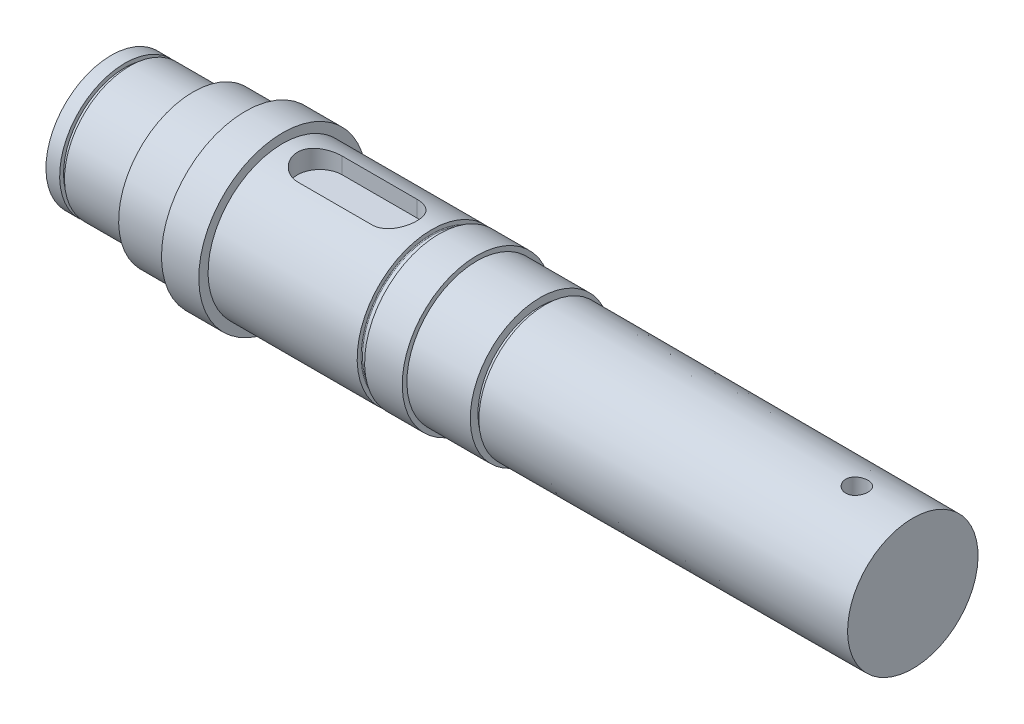
from build123d import *

# Parameters (mm, degrees)
CUT_EXTRUDE1_START = 15
CUT_EXTRUDE1_DEPTH = 6.2
SKETCH3_R          = 3
CUT_EXTRUDE2_DEPTH = 25


with BuildPart() as part:
    # Sketch1 → Revolve1 (revolve)
    with BuildSketch(Plane.XY):
        with BuildLine():
            Line((5.814948309, -5.914886223), (5.814948309, 11.585113777))
            Line((5.814948309, 11.585113777), (9.483069109, 11.585113777))
            Line((9.483069109, 11.585113777), (9.483069109, 10.535113777))
            Line((9.483069109, 10.535113777), (10.783069109, 10.535113777))
            Line((10.783069109, 10.535113777), (10.783069109, 11.585113777))
            Line((10.783069109, 11.585113777), (27.814948309, 11.585113777))
            Line((27.814948309, 11.585113777), (27.814948309, 14.085113777))
            Line((27.814948309, 14.085113777), (41.814948309, 14.085113777))
            Line((41.814948309, 14.085113777), (41.814948309, 16.585113777))
            Line((41.814948309, 16.585113777), (51.814948309, 16.585113777))
            Line((51.814948309, 16.585113777), (51.814948309, 14.085113777))
            Line((51.814948309, 14.085113777), (91.814948309, 14.085113777))
            Line((91.814948309, 14.085113777), (91.814948309, 13.045113777))
            ThreePointArc((91.814948309, 13.045113777), (91.873526953, 12.90369242), (92.014948309, 12.845113777))
            Line((92.014948309, 12.845113777), (93.614948309, 12.845113777))
            ThreePointArc((93.614948309, 12.845113777), (93.756369665, 12.90369242), (93.814948309, 13.045113777))
            Line((93.814948309, 13.045113777), (93.814948309, 14.085113777))
            Line((93.814948309, 14.085113777), (103.914948309, 14.085113777))
            Line((103.914948309, 14.085113777), (103.914948309, 12.835113777))
            Line((103.914948309, 12.835113777), (120.914948309, 12.835113777))
            Line((120.914948309, 12.835113777), (120.914948309, 10.767496152))
            Line((120.914948309, 10.767496152), (122.214948309, 10.767496152))
            Line((122.214948309, 10.767496152), (122.214948309, 11.817496152))
            Line((122.214948309, 11.817496152), (220.914948309, 11.58768633))
            Line((220.914948309, 11.58768633), (220.914948309, -5.914886223))
            Line((220.914948309, -5.914886223), (5.814948309, -5.914886223))
        make_face()
    revolve(axis=Axis((221.999449802, -5.914886223, 0), (-1, 0, 0)))

    # Sketch2 → Cut-Extrude1 (cut)
    with BuildSketch(Plane(origin=(0, 0, 0), x_dir=(1, 0, 0), z_dir=(0, 1, 0)).offset(CUT_EXTRUDE1_START)):
        with BuildLine():
            Line((61.814948309, 6), (81.814948309, 6))
            ThreePointArc((81.814948309, 6), (87.814948309, 0), (81.814948309, -6))
            Line((81.814948309, -6), (61.814948309, -6))
            ThreePointArc((61.814948309, -6), (55.814948309, 0), (61.814948309, 6))
        make_face()
    extrude(amount=-CUT_EXTRUDE1_DEPTH, mode=Mode.SUBTRACT)

    # Sketch3 → Cut-Extrude2 (cut, symmetric)
    with BuildSketch(Plane(origin=(0, 0, 0), x_dir=(1, 0, 0), z_dir=(0, 1, 0))):
        with Locations((205.914948309, 0)):
            Circle(SKETCH3_R)
    extrude(amount=CUT_EXTRUDE2_DEPTH, both=True, mode=Mode.SUBTRACT)


solid = part.part
